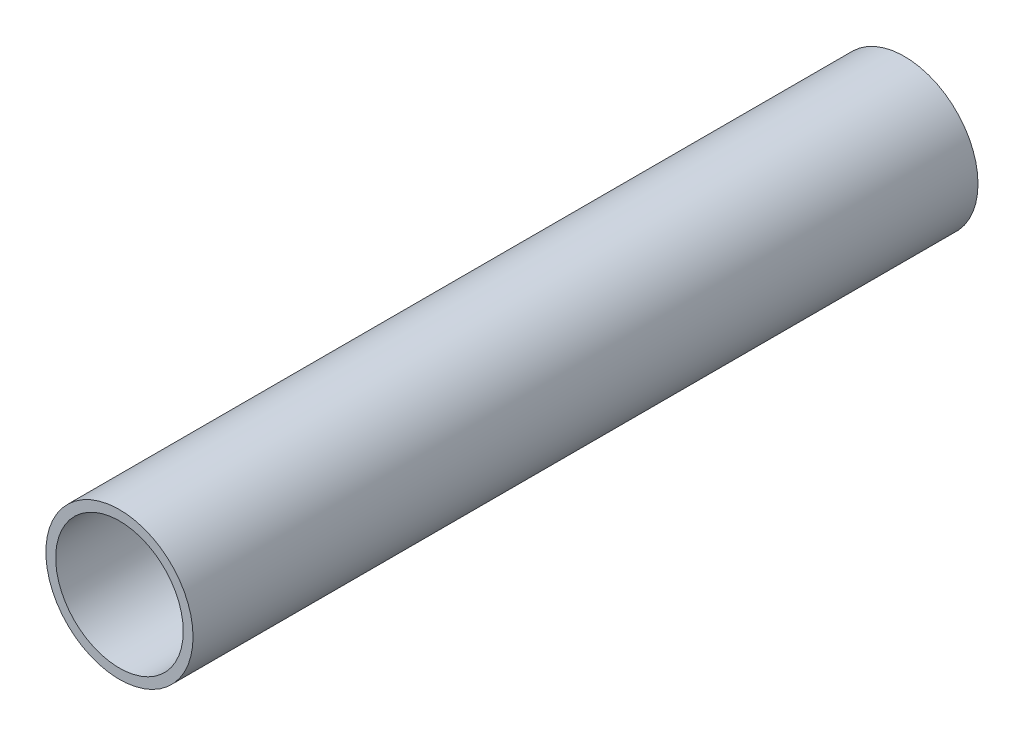
from build123d import *

# Parameters (mm, degrees)
ESQUISSE1_R        = 15
ESQUISSE1_R_2      = 13
BOSS_EXTRU_1_DEPTH = 160


with BuildPart() as part:
    # Esquisse1 → Boss.-Extru.1 (new body)
    with BuildSketch(Plane.XY):
        Circle(ESQUISSE1_R)
        Circle(ESQUISSE1_R_2, mode=Mode.SUBTRACT)
    extrude(amount=BOSS_EXTRU_1_DEPTH)


solid = part.part
